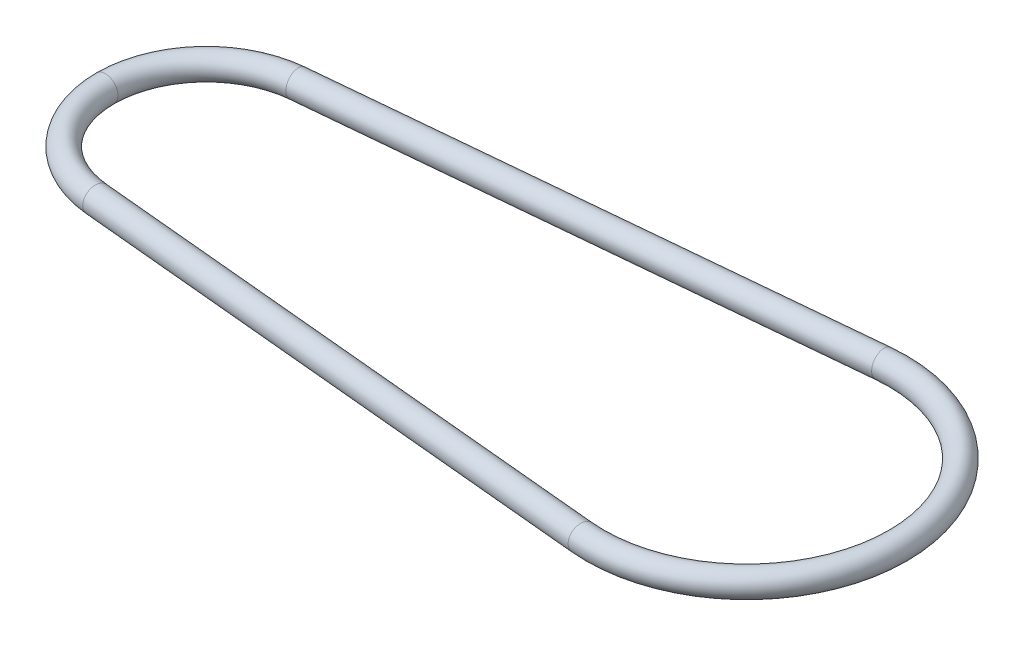
from build123d import *

# Parameters (mm, degrees)
SKETCH2_R = 3.175


with BuildPart() as part:
    # Sweep1: sweep along a path in Sketch1
    with BuildLine(Plane(origin=(0, 0, 0), x_dir=(1, 0, 0), z_dir=(0, 1, 0))) as sweep1_path:
        Line((-2.369611847, 25.289225763), (132.577582229, 37.933838645))
        ThreePointArc((132.577582229, 37.933838645), (174.232, 0), (132.577582229, -37.933838645))
        Line((132.577582229, -37.933838645), (-2.369611847, -25.289225763))
        ThreePointArc((-2.369611847, -25.289225763), (-25.4, 0), (-2.369611847, 25.289225763))
    # Sketch2 → Sweep1 (sweep)
    with BuildSketch(Plane.XY):
        with Locations((-25.4, 0)):
            Circle(SKETCH2_R)
    sweep(path=sweep1_path.line)


solid = part.part
